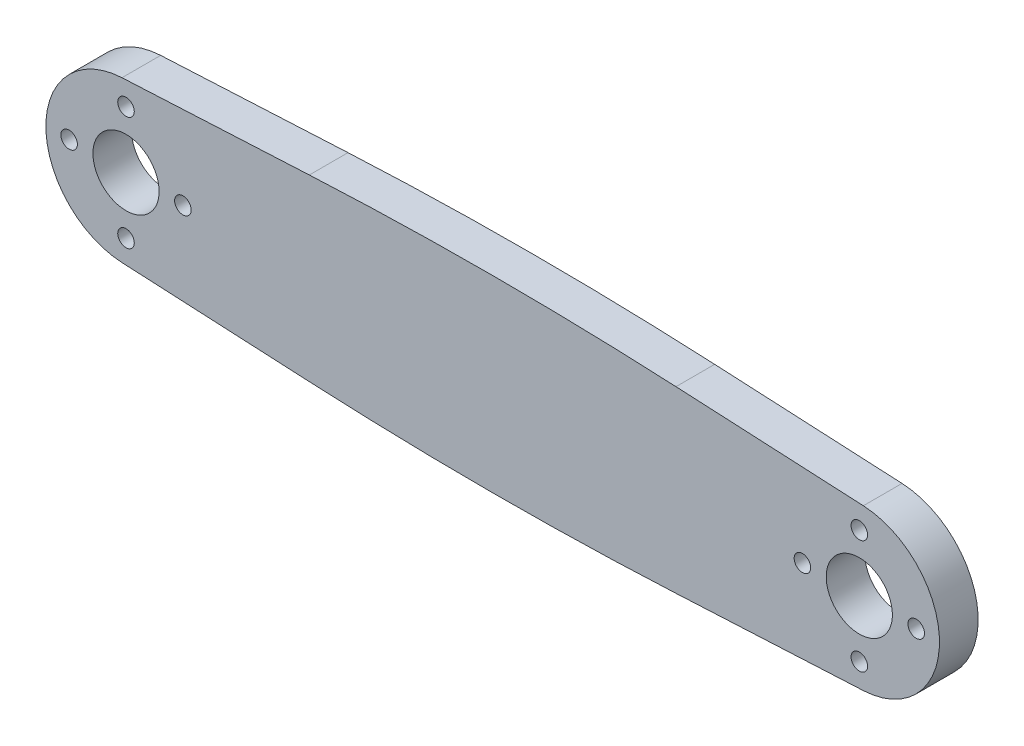
from build123d import *

# Parameters (mm, degrees)
BOSS_EXTRUDE1_DEPTH     = 4.7498
CUT_EXTRUDE4_DEPTH      = 57.268848798
CUT_EXTRUDE4_DEPTH_BACK = 57.268848798
SKETCH1_4_R             = 4.064
SKETCH1_4_R_2           = 1.016


with BuildPart() as part:
    # Sketch1 → Boss-Extrude1 (new body)
    with BuildSketch(Plane.XY):
        with BuildLine():
            Line((-45.517091875, 9.830015002), (-22.51075, 10.989907038))
            ThreePointArc((-22.51075, 10.989907038), (0, 11.557), (22.51075, 10.989907038))
            Line((22.51075, 10.989907038), (45.517091875, 9.830015002))
            ThreePointArc((45.517091875, 9.830015002), (54.864, 0), (45.517091875, -9.830015002))
            Line((45.517091875, -9.830015002), (22.51075, -10.989907038))
            ThreePointArc((22.51075, -10.989907038), (0, -11.557), (-22.51075, -10.989907038))
            Line((-22.51075, -10.989907038), (-45.517091875, -9.830015002))
            ThreePointArc((-45.517091875, -9.830015002), (-54.864, 0), (-45.517091875, 9.830015002))
        make_face()
    extrude(amount=BOSS_EXTRUDE1_DEPTH)

    # Sketch1<4> → Cut-Extrude4 (cut, two sides: drawn at the far end of the back side and taken through both)
    with BuildSketch(Plane.XY.offset(-CUT_EXTRUDE4_DEPTH_BACK)):
        with Locations((-45.0215, 0)):
            Circle(SKETCH1_4_R)
        with Locations((45.0215, 0)):
            Circle(SKETCH1_4_R)
        with Locations((-45.0215, 6.985)):
            Circle(SKETCH1_4_R_2)
        with Locations((-38.0365, 0)):
            Circle(SKETCH1_4_R_2)
        with Locations((-45.0215, -6.985)):
            Circle(SKETCH1_4_R_2)
        with Locations((-52.0065, 0)):
            Circle(SKETCH1_4_R_2)
        with Locations((45.0215, 6.985)):
            Circle(SKETCH1_4_R_2)
        with Locations((52.0065, 0)):
            Circle(SKETCH1_4_R_2)
        with Locations((45.0215, -6.985)):
            Circle(SKETCH1_4_R_2)
        with Locations((38.0365, 0)):
            Circle(SKETCH1_4_R_2)
    extrude(amount=CUT_EXTRUDE4_DEPTH + CUT_EXTRUDE4_DEPTH_BACK, mode=Mode.SUBTRACT)


solid = part.part
